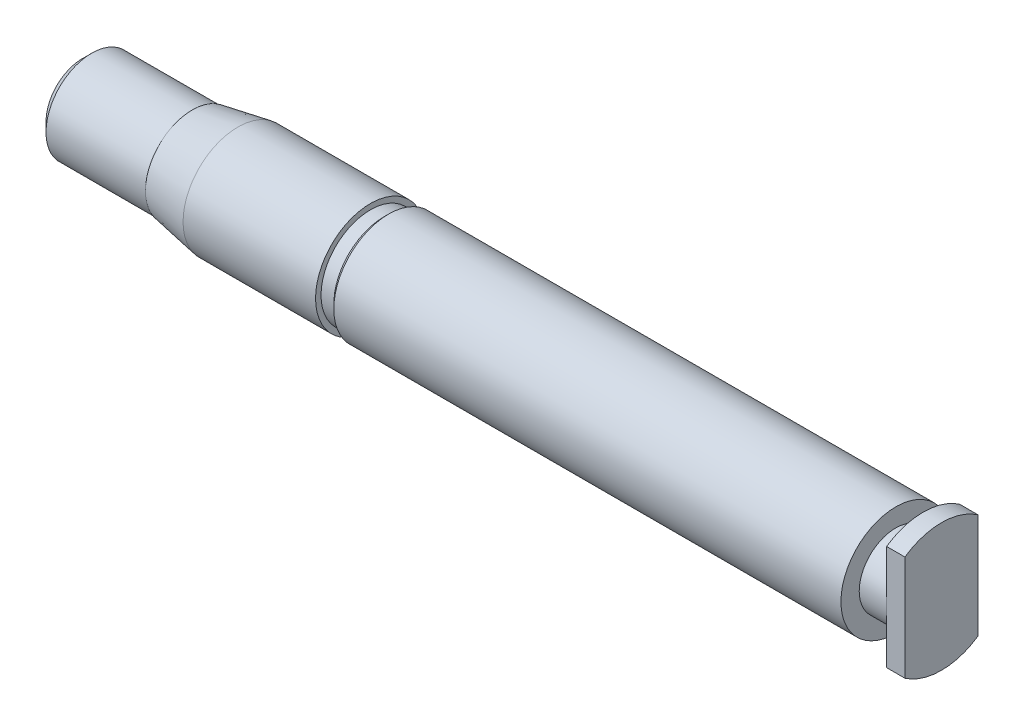
from build123d import *

# Parameters (mm, degrees)
CHANFREIN1_SIZE         = 1
CHANFREIN2_SIZE         = 0.5
ENL_V_MAT_EXTRU_1_REACH = 96.52
ESQUISSE2_W             = 5.137351374
ESQUISSE2_H             = 15.268552686


with BuildPart() as part:
    # Esquisse1 → Révolution1 (revolve)
    with BuildSketch(Plane.XY, mode=Mode.PRIVATE) as r_volution1_sk:
        Polygon((0, 0), (0, 5), (12, 5), (12, 5.118365096), (17, 6), (31.5, 6), (31.5, 5.4), (33, 5.4), (33, 6), (89, 6), (89, 4), (92, 4), (92, 7), (94, 7), (94, 0), align=None)
    revolve(r_volution1_sk.sketch.rotate(Axis((0, 0, 0), (1, 0, 0)), 90), axis=Axis((0, 0, 0), (1, 0, 0)))

    # Chanfrein1
    chanfrein1_edges = [part.edges().sort_by_distance(p)[0] for p in [
        (0, 0, -5),
    ]]
    chamfer(chanfrein1_edges, length=CHANFREIN1_SIZE)

    # Chanfrein2
    chanfrein2_edges = [part.edges().sort_by_distance(p)[0] for p in [
        (33, 0, -6),
    ]]
    chamfer(chanfrein2_edges, length=CHANFREIN2_SIZE)

    # Esquisse2 → Enlèv. mat.-Extru.1 (cut, up to next)
    with BuildSketch(Plane(origin=(94, 0, 0), x_dir=(0, 0, -1), z_dir=(1, 0, 0)), mode=Mode.PRIVATE) as enl_v_mat_extru_1_sk1:
        with Locations((-6.568675687, -0.086100861)):
            Rectangle(ESQUISSE2_W, ESQUISSE2_H)
    enl_v_mat_extru_1_tool1 = extrude(enl_v_mat_extru_1_sk1.sketch, amount=-ENL_V_MAT_EXTRU_1_REACH, mode=Mode.PRIVATE) & part.part
    # Esquisse2 → Enlèv. mat.-Extru.1 (cut, up to next)
    with BuildSketch(Plane(origin=(94, 0, 0), x_dir=(0, 0, -1), z_dir=(1, 0, 0)), mode=Mode.PRIVATE) as enl_v_mat_extru_1_sk2:
        with Locations((6.568675687, -0.086100861)):
            Rectangle(ESQUISSE2_W, ESQUISSE2_H)
    enl_v_mat_extru_1_tool2 = extrude(enl_v_mat_extru_1_sk2.sketch, amount=-ENL_V_MAT_EXTRU_1_REACH, mode=Mode.PRIVATE) & part.part
    add(enl_v_mat_extru_1_tool1.solids().sort_by_distance((94, -0.086101, 6.568676))[0], mode=Mode.SUBTRACT)
    add(enl_v_mat_extru_1_tool2.solids().sort_by_distance((94, -0.086101, -6.568676))[0], mode=Mode.SUBTRACT)


solid = part.part
